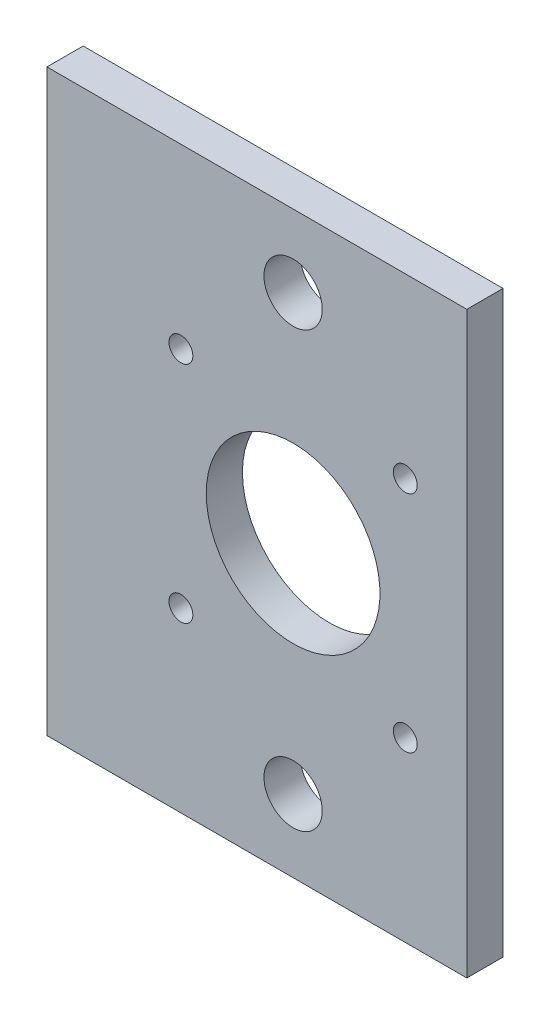
from build123d import *

# Parameters (mm, degrees)
SKETCH1_W               = 65.5
SKETCH1_H               = 80
BOSS_EXTRUDE1_DEPTH     = 5
SKETCH2_W               = 7.499999691
SKETCH2_H               = 80
CUT_EXTRUDE1_DEPTH      = 52.938064076
SKETCH3_R               = 12
SKETCH3_R_2             = 1.65
CUT_EXTRUDE2_DEPTH      = 52.938064076
CUT_EXTRUDE3_DEPTH      = 52.938064076
CUT_EXTRUDE3_DEPTH_BACK = 52.938064076
SKETCH4_R               = 4.025


with BuildPart() as part:
    # Sketch1 → Boss-Extrude1 (new body)
    with BuildSketch(Plane.XY):
        Rectangle(SKETCH1_W, SKETCH1_H)
    extrude(amount=BOSS_EXTRUDE1_DEPTH)

    # Sketch2 → Cut-Extrude1 (cut, through all)
    with BuildSketch(Plane.XY.offset(5)):
        with Locations((29.000000155, 0)):
            Rectangle(SKETCH2_W, SKETCH2_H)
    extrude(amount=-CUT_EXTRUDE1_DEPTH, mode=Mode.SUBTRACT)

    # Sketch3 → Cut-Extrude2 (cut, through all)
    with BuildSketch(Plane(origin=(0, 0, 0), x_dir=(-1, 0, 0), z_dir=(0, 0, -1))):
        with Locations((-1.25, 0)):
            Circle(SKETCH3_R)
        with Locations((-16.75, 15.5)):
            Circle(SKETCH3_R_2)
        with Locations((14.25, 15.5)):
            Circle(SKETCH3_R_2)
        with Locations((14.25, -15.5)):
            Circle(SKETCH3_R_2)
        with Locations((-16.75, -15.5)):
            Circle(SKETCH3_R_2)
    extrude(amount=-CUT_EXTRUDE2_DEPTH, mode=Mode.SUBTRACT)

    # Sketch4 → Cut-Extrude3 (cut, two sides: drawn at the far end of the back side and taken through both)
    with BuildSketch(Plane(origin=(0, 0, 0), x_dir=(-1, 0, 0), z_dir=(0, 0, -1)).offset(-CUT_EXTRUDE3_DEPTH_BACK)):
        with Locations((-1.25, 30)):
            Circle(SKETCH4_R)
        with Locations(Location((-1.25, -30, 0), (0, 0, 180))):
            Circle(SKETCH4_R)
    extrude(amount=CUT_EXTRUDE3_DEPTH + CUT_EXTRUDE3_DEPTH_BACK, mode=Mode.SUBTRACT)


solid = part.part
